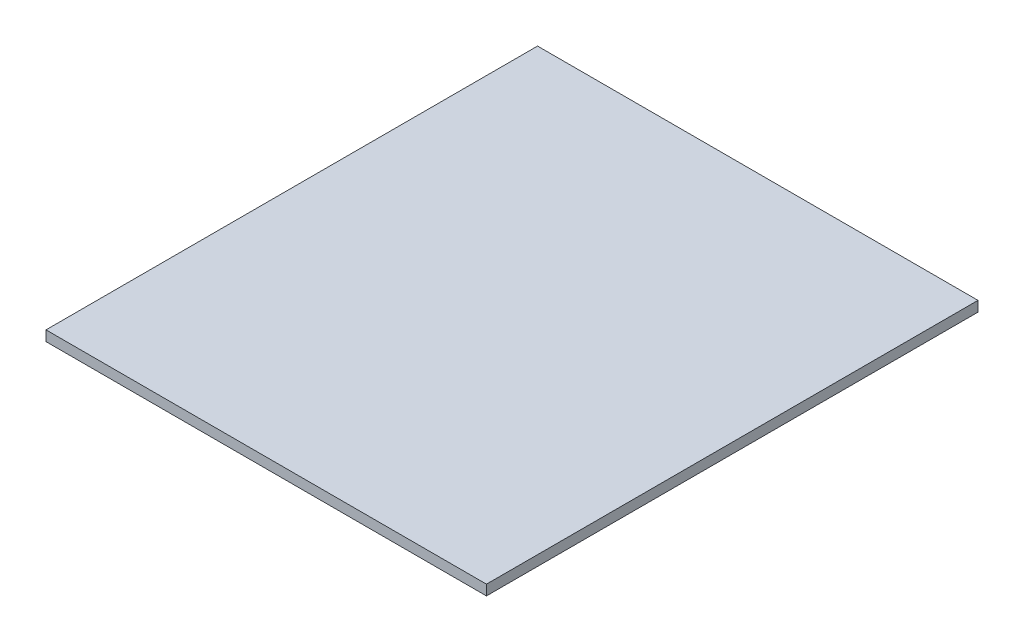
from build123d import *

# Parameters (mm, degrees)
SKETCH1_W           = 344.8
SKETCH1_H           = 384.8
BOSS_EXTRUDE1_DEPTH = 4


with BuildPart() as part:
    # Sketch1 → Boss-Extrude1 (new, symmetric)
    with BuildSketch(Plane(origin=(0, 0, 0), x_dir=(1, 0, 0), z_dir=(0, 1, 0))):
        Rectangle(SKETCH1_W, SKETCH1_H)
    extrude(amount=BOSS_EXTRUDE1_DEPTH, both=True)


solid = part.part
